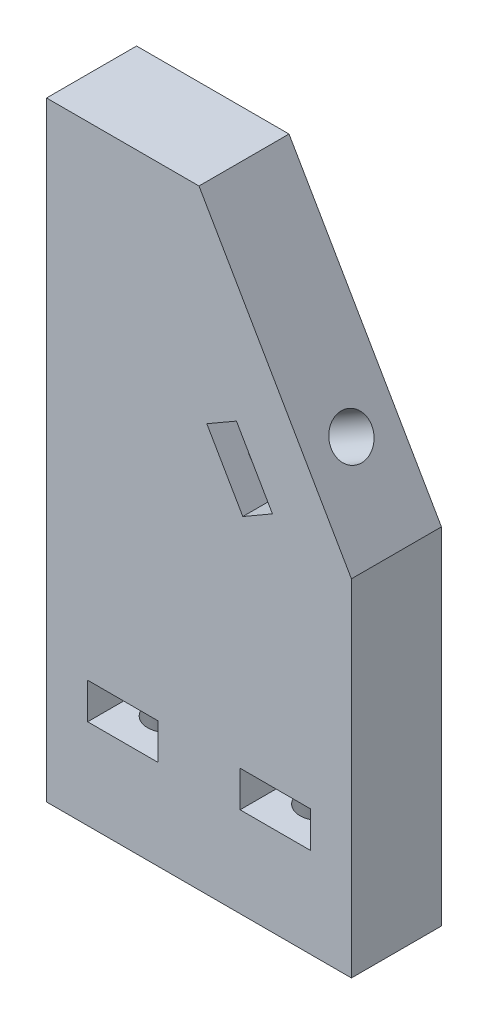
from build123d import *

# Parameters (mm, degrees)
BOSS_EXTRUDE1_DEPTH                       = 7.5
CUT_EXTRUDE1_START                        = -10
CUT_EXTRUDE1_DEPTH                        = 5.7
SKETCH5_W                                 = 3.373501
SKETCH5_H                                 = 31.997045256
CUT_EXTRUDE2_START                        = -15
CUT_EXTRUDE2_DEPTH                        = 6
SKETCH8_W                                 = 3.373501
SKETCH8_H                                 = 15
F_17_64_0_26563_DIAMETER_HOLE2_AT_2_COUNT = 2
F_17_64_0_26563_DIAMETER_HOLE2_AT_2_PITCH = 25.4
CUT_EXTRUDE4_START                        = -31
SKETCH10_R                                = 3.373501
CUT_EXTRUDE4_DEPTH                        = 31
CUT_EXTRUDE5_START                        = -25.7
SKETCH11_R                                = 3.373501
CUT_EXTRUDE5_DEPTH                        = 25.7


with BuildPart() as part:
    # Sketch1 → Boss-Extrude1 (new, symmetric)
    with BuildSketch(Plane.XY):
        Polygon((0, -28.802954744), (0, 28.802954744), (-25.4, 72.797045256), (-50.8, 72.797045256), (-50.8, -28.802954744), (-25.4, -28.802954744), align=None)
    extrude(amount=BOSS_EXTRUDE1_DEPTH, both=True)

    # Sketch2 → Cut-Extrude1 (cut)
    with BuildSketch(Plane(origin=(12.472045256, 7.200738686, 0), x_dir=(0, 0, -1), z_dir=(0.8660254037844379, 0.5000000000000013, 0)).offset(CUT_EXTRUDE1_START)):
        Polygon((3.464101615, 33.944090512), (7.5, 33.944090512), (7.5, 45.944090512), (3.464101615, 45.944090512), (-3.464101615, 45.944090512), (-7.5, 45.944090512), (-7.5, 33.944090512), (-3.464101615, 33.944090512), align=None)
    extrude(amount=-CUT_EXTRUDE1_DEPTH, mode=Mode.SUBTRACT)

    # Sketch5 → 17/64 (0.26563) Diameter Hole1 (revolve, cut)
    with BuildSketch(Plane(origin=(-16.160254038, 36.793335801, 0), x_dir=(0.500000000000001, -0.866025403784438, 0), z_dir=(0, 0, 1))):
        with Locations((1.6867505, 15.998522628)):
            Rectangle(SKETCH5_W, SKETCH5_H)
    revolve(axis=Axis((-21.659515352, 33.618335801, 0), (0.866025403784438, 0.500000000000001, 0)), mode=Mode.SUBTRACT)

    # Sketch6 → Cut-Extrude2 (cut)
    with BuildSketch(Plane.XZ.offset(28.802954744).offset(CUT_EXTRUDE2_START)):
        Polygon((-43.95, 3.377499075), (-43.95, -3.377499075), (-43.95, -7.5), (-32.25, -7.5), (-32.25, -3.377499075), (-32.25, 3.377499075), (-32.25, 7.5), (-43.95, 7.5), align=None)
        Polygon((-18.55, 3.377499075), (-18.55, -3.377499075), (-18.55, -7.5), (-6.85, -7.5), (-6.85, -3.377499075), (-6.85, 3.377499075), (-6.85, 7.5), (-18.55, 7.5), align=None)
    extrude(amount=-CUT_EXTRUDE2_DEPTH, mode=Mode.SUBTRACT)

    # Sketch8 → 17/64 (0.26563) Diameter Hole2 (revolve, cut)
    with BuildSketch(Plane(origin=(-38.1, -13.802954744, 0), x_dir=(0, 0, 1), z_dir=(1, 0, 0))):
        with Locations((1.6867505, 7.5)):
            Rectangle(SKETCH8_W, SKETCH8_H)
    f_17_64_0_26563_diameter_hole2 = revolve(axis=Axis((-38.1, -7.452954744, 0), (0, -1, 0)), mode=Mode.SUBTRACT)

    # 17/64 (0.26563) Diameter Hole2 at 2: 17/64 (0.26563) Diameter Hole2 ×2
    with Locations(*[(i * F_17_64_0_26563_DIAMETER_HOLE2_AT_2_PITCH, 0, 0) for i in range(1, F_17_64_0_26563_DIAMETER_HOLE2_AT_2_COUNT)]):
        add(f_17_64_0_26563_diameter_hole2, mode=Mode.SUBTRACT)

    # Sketch10 → Cut-Extrude4 (cut)
    with BuildSketch(Plane.XZ.offset(28.802954744).offset(CUT_EXTRUDE4_START)):
        with Locations(Location((-38.1, 0, 0), (0, 0, 90))):
            Circle(SKETCH10_R)
        with Locations(Location((-12.7, 0, 0), (0, 0, 90))):
            Circle(SKETCH10_R)
    extrude(amount=CUT_EXTRUDE4_DEPTH, mode=Mode.SUBTRACT)

    # Sketch11 → Cut-Extrude5 (cut)
    with BuildSketch(Plane(origin=(12.472045256, 7.200738686, 0), x_dir=(0, 0, -1), z_dir=(0.8660254037844378, 0.5000000000000017, 0)).offset(CUT_EXTRUDE5_START)):
        with Locations(Location((0, 39.944090512, 0), (0, 0, 270))):
            Circle(SKETCH11_R)
    extrude(amount=CUT_EXTRUDE5_DEPTH, mode=Mode.SUBTRACT)


solid = part.part
